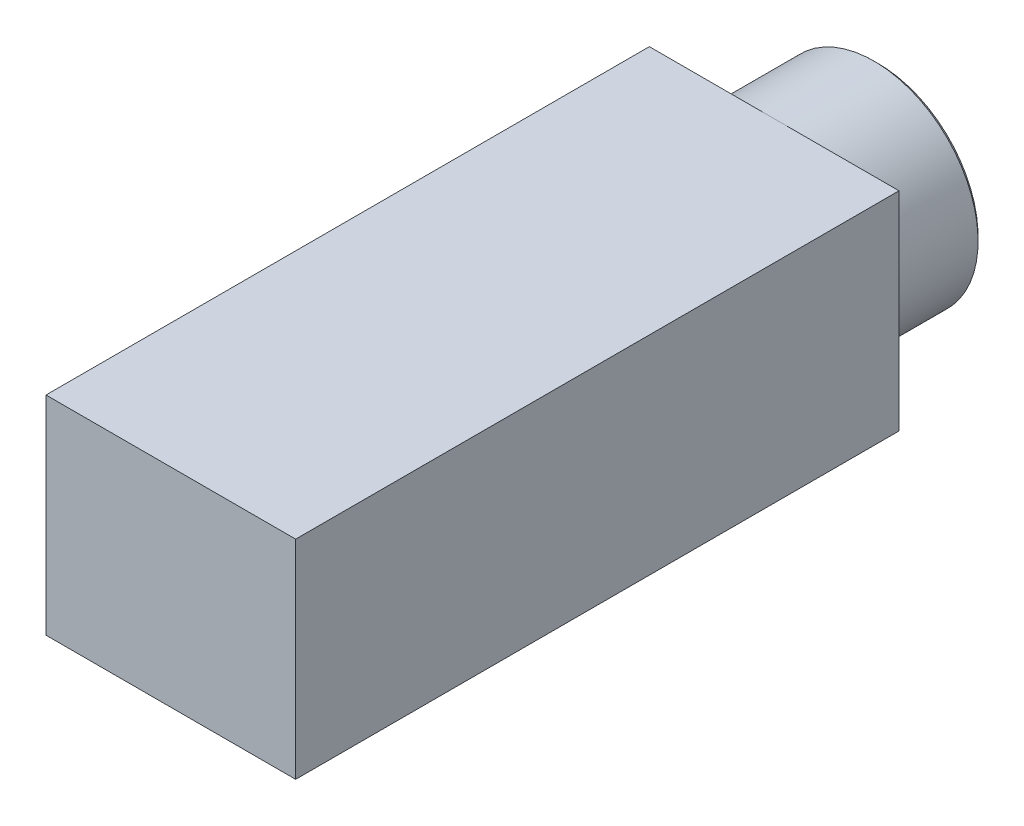
from build123d import *

# Parameters (mm, degrees)
SKETCH1_W           = 6
SKETCH1_H           = 5
BOSS_EXTRUDE1_DEPTH = 14.5
SKETCH2_R           = 2.5
BOSS_EXTRUDE2_DEPTH = 2.5
SKETCH3_R           = 1.8
CUT_EXTRUDE1_DEPTH  = 2.5
CHAMFER1_SIZE       = 0.1


with BuildPart() as part:
    # Sketch1 → Boss-Extrude1 (new body)
    with BuildSketch(Plane.XY):
        Rectangle(SKETCH1_W, SKETCH1_H)
    extrude(amount=BOSS_EXTRUDE1_DEPTH)

    # Sketch2 → Boss-Extrude2 (add)
    with BuildSketch(Plane(origin=(0, 0, 0), x_dir=(-1, 0, 0), z_dir=(0, 0, -1))):
        with Locations(Location((0, 0, 0), (0, 0, 270))):
            Circle(SKETCH2_R)
    extrude(amount=BOSS_EXTRUDE2_DEPTH)

    # Sketch3 → Cut-Extrude1 (cut)
    with BuildSketch(Plane(origin=(0, 0, -2.5), x_dir=(-1, 0, 0), z_dir=(0, 0, -1))):
        Circle(SKETCH3_R)
    extrude(amount=-CUT_EXTRUDE1_DEPTH, mode=Mode.SUBTRACT)

    # Chamfer1
    chamfer1_edges = [part.edges().sort_by_distance(p)[0] for p in [
        (0, 2.5, -2.5),
    ]]
    chamfer(chamfer1_edges, length=CHAMFER1_SIZE)


solid = part.part
